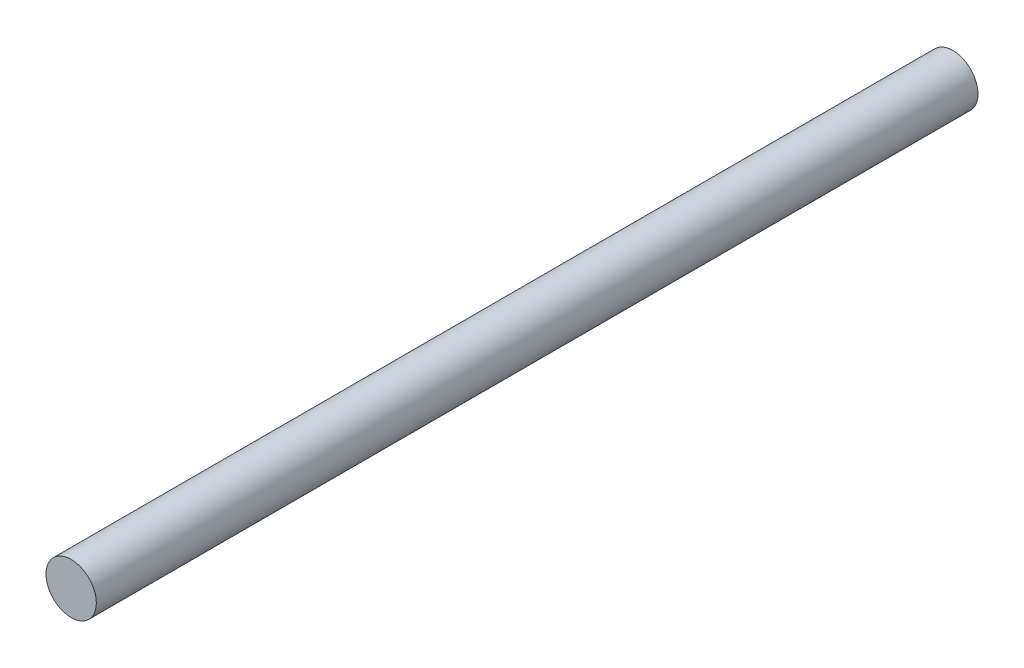
from build123d import *

# Parameters (mm, degrees)
ESQUISSE1_R        = 2
BOSS_EXTRU_1_DEPTH = 70


with BuildPart() as part:
    # Esquisse1 → Boss.-Extru.1 (new body)
    with BuildSketch(Plane.XY):
        Circle(ESQUISSE1_R)
    extrude(amount=BOSS_EXTRU_1_DEPTH)


solid = part.part
